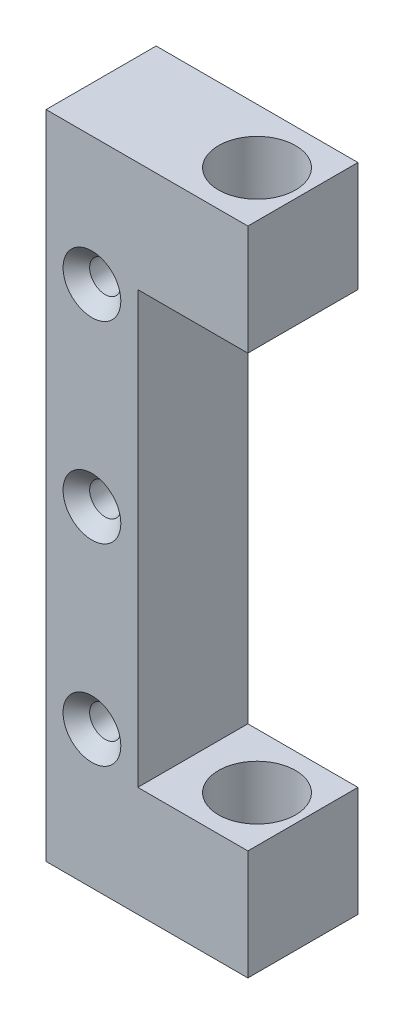
from build123d import *

# Parameters (mm, degrees)
AUFSATZ_LINEAR_AUSTRAGEN1_DEPTH                      = 12
FORMSENKUNG_F_R_M3_LINSENSENKSCHRAUBE_MI_D           = 3.4
FORMSENKUNG_F_R_M3_LINSENSENKSCHRAUBE_MI_CSINK_D     = 6.3
FORMSENKUNG_F_R_M3_LINSENSENKSCHRAUBE_MI_CSINK_ANGLE = 90
F_8_4_8_4_DURCHMESSER_BOHRUNG3_D                     = 8.4


with BuildPart() as part:
    # Skizze1 → Aufsatz-Linear austragen1 (new body)
    with BuildSketch(Plane.XY):
        Polygon((0, 0), (0, 71), (22, 71), (22, 59), (10, 59), (10, 12), (22, 12), (22, 0), align=None)
    extrude(amount=AUFSATZ_LINEAR_AUSTRAGEN1_DEPTH)

    # Formsenkung für M3 Linsensenkschraube mit Schlitz2 (through all)
    with Locations(Plane.XY.offset(12)):
        with Locations((5, 57), (5, 36), (5, 15)):
            CounterSinkHole(FORMSENKUNG_F_R_M3_LINSENSENKSCHRAUBE_MI_D / 2, FORMSENKUNG_F_R_M3_LINSENSENKSCHRAUBE_MI_CSINK_D / 2, counter_sink_angle=FORMSENKUNG_F_R_M3_LINSENSENKSCHRAUBE_MI_CSINK_ANGLE)

    # Ø8.4 (8.4) Durchmesser Bohrung3 (through all)
    with Locations(Plane(origin=(0, 71, 0), x_dir=(1, 0, 0), z_dir=(0, 1, 0))):
        with Locations((17, -6)):
            Hole(F_8_4_8_4_DURCHMESSER_BOHRUNG3_D / 2)


solid = part.part
